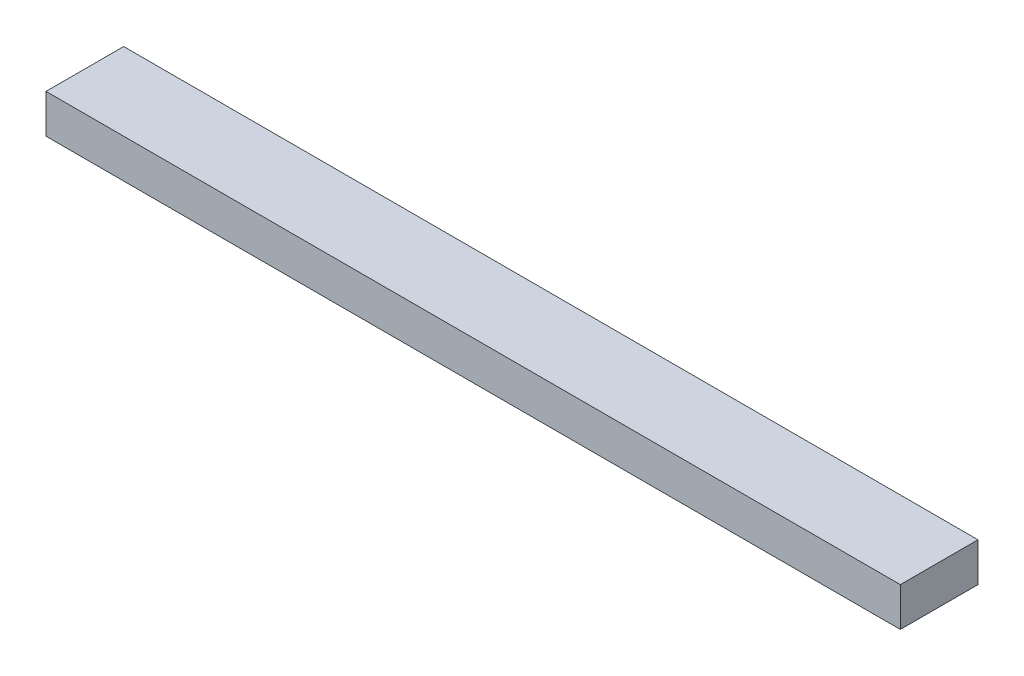
from build123d import *

# Parameters (mm, degrees)
SKETCH1_W           = 110
SKETCH1_H           = 10
BOSS_EXTRUDE1_DEPTH = 5


with BuildPart() as part:
    # Sketch1 → Boss-Extrude1 (new body)
    with BuildSketch(Plane(origin=(0, 0, 0), x_dir=(1, 0, 0), z_dir=(0, 1, 0))):
        Rectangle(SKETCH1_W, SKETCH1_H)
    extrude(amount=BOSS_EXTRUDE1_DEPTH)


solid = part.part
